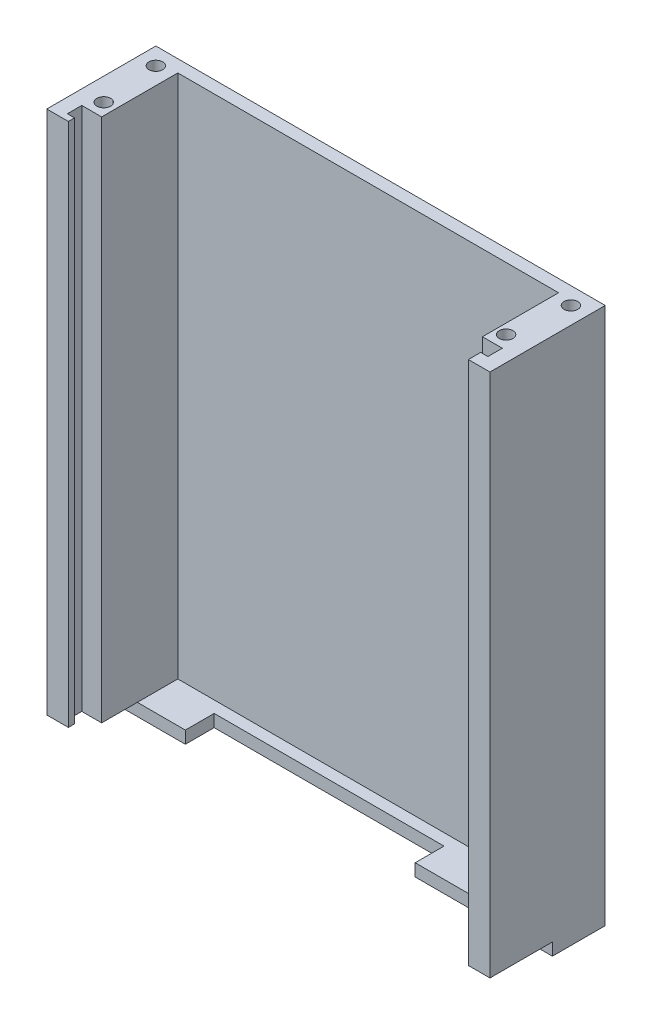
from build123d import *

# Parameters (mm, degrees)
CROQUIS1_W              = 65.5
CROQUIS1_H              = 76.5
SALIENTE_EXTRUIR1_DEPTH = 1.8
CROQUIS2_W              = 5
CROQUIS2_H              = 76.5
SALIENTE_EXTRUIR2_DEPTH = 15
CORTAR_EXTRUIR1_DEPTH   = 76.5
SALIENTE_EXTRUIR4_DEPTH = 1.8
CROQUIS7_W              = 13.85
CROQUIS7_H              = 23
SALIENTE_EXTRUIR5_DEPTH = 3
CORTAR_EXTRUIR5_DEPTH   = 23
CROQUIS10_R             = 1
CORTAR_EXTRUIR6_DEPTH   = 8
CORTAR_EXTRUIR7_START   = -8
CROQUIS11_R             = 1
CORTAR_EXTRUIR7_DEPTH   = 8
CROQUIS12_R             = 1
CORTAR_EXTRUIR8_DEPTH   = 8


with BuildPart() as part:
    # Croquis1 → Saliente-Extruir1 (new body)
    with BuildSketch(Plane.XY):
        with Locations((-58.211538462, -3.442307692)):
            Rectangle(CROQUIS1_W, CROQUIS1_H)
    extrude(amount=SALIENTE_EXTRUIR1_DEPTH)

    # Croquis2 → Saliente-Extruir2 (add)
    with BuildSketch(Plane.XY.offset(1.8)):
        with Locations((-88.461538462, -3.442307692)):
            Rectangle(CROQUIS2_W, CROQUIS2_H)
        with Locations((-27.961538462, -3.442307692)):
            Rectangle(CROQUIS2_W, CROQUIS2_H)
    extrude(amount=SALIENTE_EXTRUIR2_DEPTH)

    # Croquis3 → Cortar-Extruir1 (cut)
    with BuildSketch(Plane.XZ.offset(41.692307692)):
        Polygon((-89.111538462, 15.9), (-87.811538462, 15.9), (-87.811538462, 15), (-88.461538462, 15), (-88.861538462, 15), (-88.861538462, 12.9), (-85.961538462, 12.9), (-85.961538462, 15), (-85.961538462, 16.8), (-89.111538462, 16.8), (-90.961538462, 16.8), (-90.961538462, 15.9), align=None)
        Polygon((-30.461538462, 15), (-30.461538462, 12.9), (-27.561538462, 12.9), (-27.561538462, 15), (-28.611538462, 15), (-28.611538462, 15.9), (-28.611538462, 16.8), (-30.461538462, 16.8), align=None)
    extrude(amount=-CORTAR_EXTRUIR1_DEPTH, mode=Mode.SUBTRACT)

    # Croquis6 → Saliente-Extruir4 (add)
    with BuildSketch(Plane.XZ.offset(41.692307692)):
        Polygon((-85.961538462, 7.7), (-78.961538462, 7.7), (-78.961538462, 3.5), (-45.461538462, 3.5), (-45.461538462, 7.7), (-30.461538462, 7.7), (-25.461538462, 7.7), (-25.461538462, 0), (-90.961538462, 0), (-90.961538462, 7.7), align=None)
    extrude(amount=SALIENTE_EXTRUIR4_DEPTH)

    # Croquis7 → Saliente-Extruir5 (add)
    with BuildSketch(Plane(origin=(0, 0, 0), x_dir=(-1, 0, 0), z_dir=(0, 0, -1))):
        with Locations((58.211538462, -4.342307692)):
            Rectangle(CROQUIS7_W, CROQUIS7_H)
    extrude(amount=SALIENTE_EXTRUIR5_DEPTH)

    # Croquis9 → Cortar-Extruir5 (cut)
    with BuildSketch(Plane.XZ.offset(15.842307692)):
        Polygon((-51.286538462, -3), (-54.286538462, 0), (-51.286538462, 0), align=None)
        Polygon((-65.136538462, -3), (-62.136538462, 0), (-65.136538462, 0), align=None)
    extrude(amount=-CORTAR_EXTRUIR5_DEPTH, mode=Mode.SUBTRACT)

    # Croquis10 → Cortar-Extruir6 (cut)
    with BuildSketch(Plane.XZ.offset(41.692307692)):
        with Locations(Location((-87.661538462, 10.9, 0), (0, 0, 270))):
            Circle(CROQUIS10_R)
        with Locations(Location((-29.011538462, 10.9, 0), (0, 0, 270))):
            Circle(CROQUIS10_R)
    extrude(amount=-CORTAR_EXTRUIR6_DEPTH, mode=Mode.SUBTRACT)

    # Croquis11 → Cortar-Extruir7 (cut)
    with BuildSketch(Plane(origin=(0, 34.807692308, 0), x_dir=(1, 0, 0), z_dir=(0, 1, 0)).offset(CORTAR_EXTRUIR7_START)):
        with Locations(Location((-29.011538462, -10.9, 0), (0, 0, 90))):
            Circle(CROQUIS11_R)
        with Locations(Location((-87.661538462, -10.9, 0), (0, 0, 90))):
            Circle(CROQUIS11_R)
    extrude(amount=CORTAR_EXTRUIR7_DEPTH, mode=Mode.SUBTRACT)

    # Croquis12 → Cortar-Extruir8 (cut)
    with BuildSketch(Plane(origin=(0, 34.807692308, 0), x_dir=(1, 0, 0), z_dir=(0, 1, 0))):
        with Locations(Location((-27.961538462, -2.5, 0), (0, 0, 270))):
            Circle(CROQUIS12_R)
        with Locations(Location((-88.461538462, -2.5, 0), (0, 0, 270))):
            Circle(CROQUIS12_R)
    extrude(amount=-CORTAR_EXTRUIR8_DEPTH, mode=Mode.SUBTRACT)


solid = part.part
